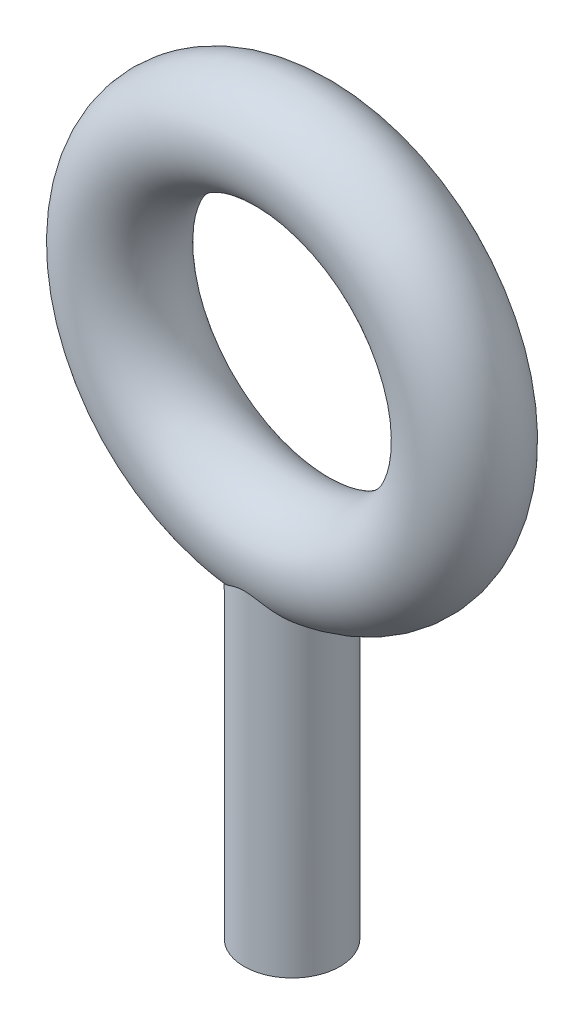
from build123d import *
from build123d.topology import SkipClean

# Parameters (mm, degrees)
SKETCH1_R           = 4.7625
SKETCH2_R           = 4.41325
BOSS_EXTRUDE1_DEPTH = 31.75


with BuildPart() as part:
    # Sketch1 → Revolve1 (revolve)
    with BuildSketch(Plane(origin=(0, 0, 0), x_dir=(0, 0, -1), z_dir=(1, 0, 0)), mode=Mode.PRIVATE) as revolve1_sk:
        with Locations((0, -15.875)):
            Circle(SKETCH1_R)
    revolve(revolve1_sk.sketch.rotate(Axis((0, 0, 14.760884762), (0, 0, -1)), 270), axis=Axis((0, 0, 14.760884762), (0, 0, -1)))

    # Sketch2 → Boss-Extrude1 (add)
    with SkipClean():  # the faces are left unmerged after this step: merging them gives an invalid solid
        with BuildSketch(Plane(origin=(0, -15.875, 0), x_dir=(1, 0, 0), z_dir=(0, 1, 0))):
            with Locations(Location((0, 0, 0), (0, 0, 270))):
                Circle(SKETCH2_R)
        extrude(amount=-BOSS_EXTRUDE1_DEPTH)


solid = part.part
